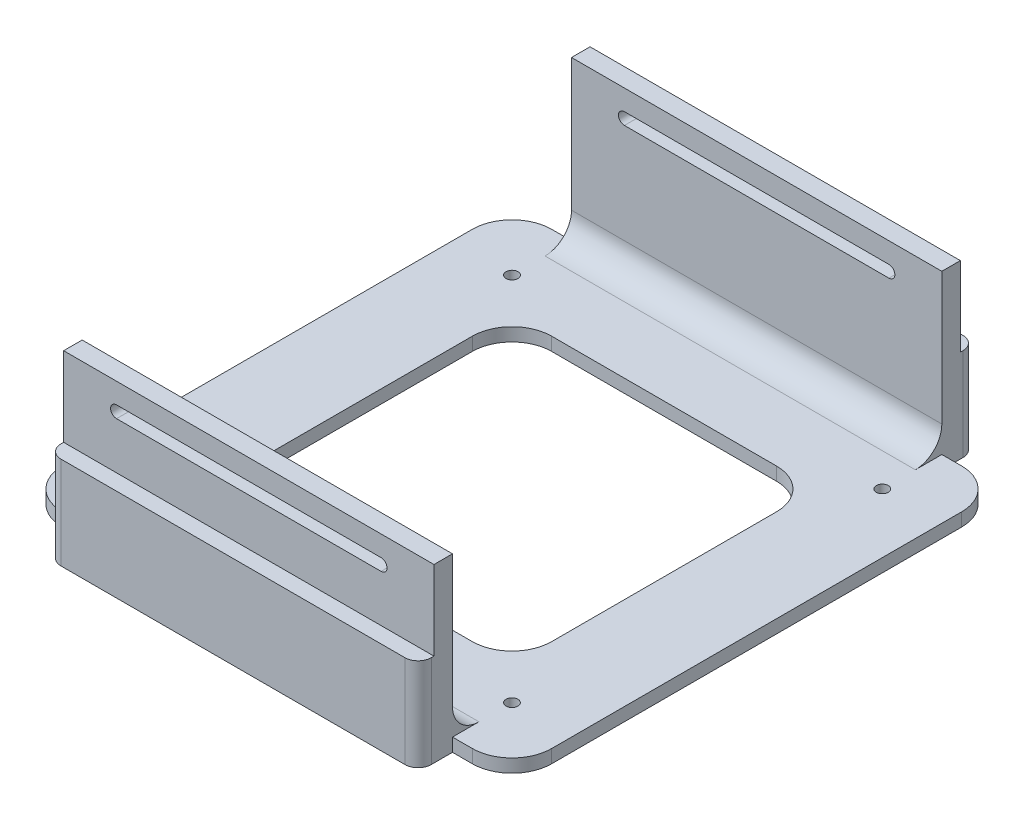
from build123d import *

# Parameters (mm, degrees)
SKETCH1_W           = 185
SKETCH1_H           = 185
SKETCH1_W_2         = 140
SKETCH1_H_2         = 13
BOSS_EXTRUDE1_DEPTH = 5
SKETCH2_W           = 140
SKETCH2_H           = 13
BOSS_EXTRUDE2_DEPTH = 30
SKETCH4_W           = 140
SKETCH4_H           = 7
BOSS_EXTRUDE3_DEPTH = 30
CUT_EXTRUDE1_DEPTH  = 1000
SKETCH6_W           = 115
SKETCH6_H           = 115
CUT_EXTRUDE2_DEPTH  = 1000
SKETCH7_R           = 2.25
CUT_EXTRUDE3_DEPTH  = 1000
FILLET1_R           = 15
FILLET2_R           = 5
FILLET3_R           = 10


with BuildPart() as part:
    # Sketch1 → Boss-Extrude1 (new body)
    with BuildSketch(Plane(origin=(0, 0, 0), x_dir=(1, 0, 0), z_dir=(0, 1, 0))):
        with Locations((9.076200418, 24.041155145)):
            Rectangle(SKETCH1_W, SKETCH1_H)
        with Locations((9.076200418, -74.958844855)):
            Rectangle(SKETCH1_W_2, SKETCH1_H_2)
        with Locations((9.076200418, 123.041155145)):
            Rectangle(SKETCH1_W_2, SKETCH1_H_2)
    extrude(amount=BOSS_EXTRUDE1_DEPTH)

    # Sketch2 → Boss-Extrude2 (add)
    with BuildSketch(Plane(origin=(0, 5, 0), x_dir=(1, 0, 0), z_dir=(0, 1, 0))):
        with Locations((9.076200418, 123.041155145)):
            Rectangle(SKETCH2_W, SKETCH2_H)
        with Locations((9.076200418, -74.958844855)):
            Rectangle(SKETCH2_W, SKETCH2_H)
    extrude(amount=BOSS_EXTRUDE2_DEPTH)

    # Sketch4 → Boss-Extrude3 (add)
    with BuildSketch(Plane(origin=(0, 35, 0), x_dir=(1, 0, 0), z_dir=(0, 1, 0))):
        with Locations((9.076200418, 120.041155145)):
            Rectangle(SKETCH4_W, SKETCH4_H)
        with Locations((9.076200418, -71.958844855)):
            Rectangle(SKETCH4_W, SKETCH4_H)
    extrude(amount=BOSS_EXTRUDE3_DEPTH)

    # Sketch5 → Cut-Extrude1 (cut)
    with BuildSketch(Plane.XY.offset(75.458844855)):
        with BuildLine():
            Line((-40.923799582, 57.25), (59.076200418, 57.25))
            ThreePointArc((59.076200418, 57.25), (61.326200418, 55), (59.076200418, 52.75))
            Line((59.076200418, 52.75), (-40.923799582, 52.75))
            ThreePointArc((-40.923799582, 52.75), (-43.173799582, 55), (-40.923799582, 57.25))
        make_face()
    extrude(amount=-CUT_EXTRUDE1_DEPTH, mode=Mode.SUBTRACT)

    # Sketch6 → Cut-Extrude2 (cut)
    with BuildSketch(Plane(origin=(0, 5, 0), x_dir=(1, 0, 0), z_dir=(0, 1, 0))):
        with Locations((9.076200418, 24.041155145)):
            Rectangle(SKETCH6_W, SKETCH6_H)
    extrude(amount=-CUT_EXTRUDE2_DEPTH, mode=Mode.SUBTRACT)

    # Sketch7 → Cut-Extrude3 (cut)
    with BuildSketch(Plane(origin=(0, 5, 0), x_dir=(1, 0, 0), z_dir=(0, 1, 0))):
        with Locations(Location((-60.923799582, 94.041155145, 0), (0, 0, 270))):
            Circle(SKETCH7_R)
        with Locations(Location((79.076200418, 94.041155145, 0), (0, 0, 270))):
            Circle(SKETCH7_R)
        with Locations(Location((79.076200418, -45.958844855, 0), (0, 0, 270))):
            Circle(SKETCH7_R)
        with Locations(Location((-60.923799582, -45.958844855, 0), (0, 0, 270))):
            Circle(SKETCH7_R)
    extrude(amount=-CUT_EXTRUDE3_DEPTH, mode=Mode.SUBTRACT)

    # Fillet1
    fillet1_edges = [part.edges().sort_by_distance(p)[0] for p in [
        (-48.423799582, 2.5, 33.458844855),
        (-48.423799582, 2.5, -81.541155145),
        (66.576200418, 2.5, -81.541155145),
        (66.576200418, 2.5, 33.458844855),
        (101.576200418, 2.5, 68.458844855),
        (-83.423799582, 2.5, 68.458844855),
        (-83.423799582, 2.5, -116.541155145),
        (101.576200418, 2.5, -116.541155145),
    ]]
    fillet(fillet1_edges, radius=FILLET1_R)

    # Fillet2
    fillet2_edges = [part.edges().sort_by_distance(p)[0] for p in [
        (79.076200418, 17.5, 81.458844855),
        (-60.923799582, 17.5, 81.458844855),
        (-60.923799582, 17.5, -129.541155145),
        (79.076200418, 17.5, -129.541155145),
    ]]
    fillet(fillet2_edges, radius=FILLET2_R)

    # Fillet3
    fillet3_edges = [part.edges().sort_by_distance(p)[0] for p in [
        (9.076200418, 5, -116.541155145),
        (9.076200418, 5, 68.458844855),
    ]]
    fillet(fillet3_edges, radius=FILLET3_R)


solid = part.part
